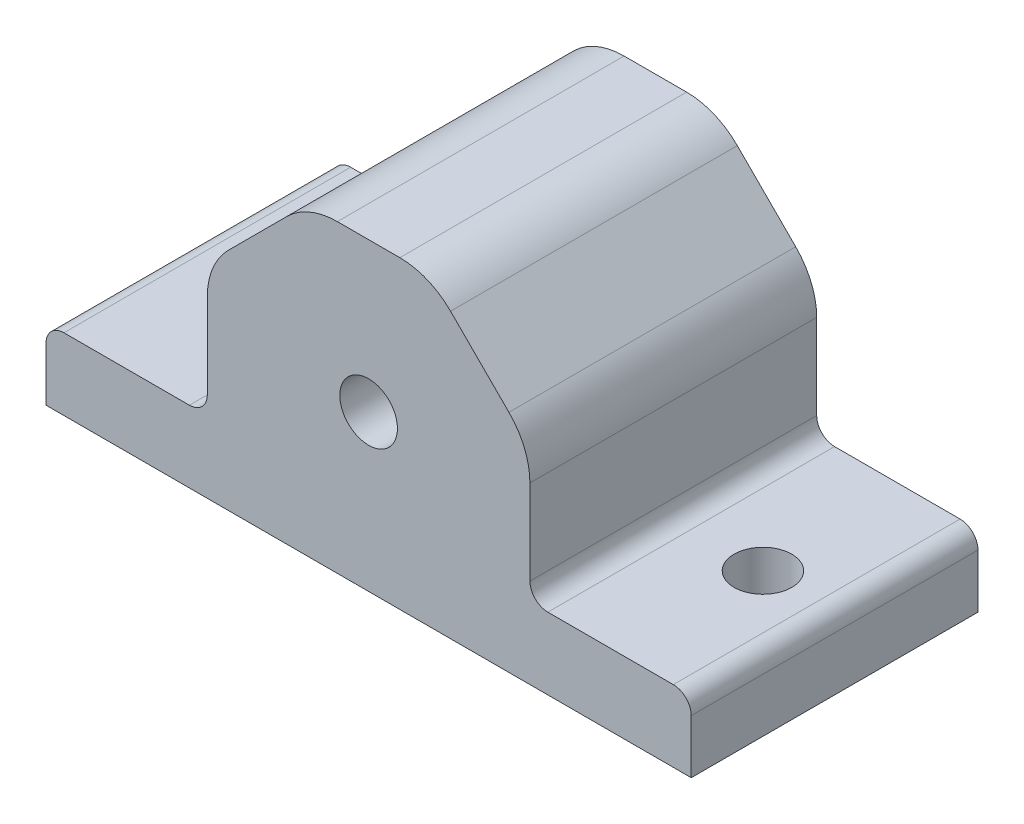
from build123d import *

# Parameters (mm, degrees)
BOSS_EXTRUDE1_DEPTH = 25.4
FILLET1_R           = 1.5875
FILLET3_R           = 6.35
SKETCH2_R           = 2.5527
CUT_EXTRUDE1_DEPTH  = 47.797604439
SKETCH4_R           = 2.5527
CUT_EXTRUDE2_DEPTH  = 47.797604439


with BuildPart() as part:
    # Sketch1 → Boss-Extrude1 (new body)
    with BuildSketch(Plane.XY):
        Polygon((-5.3975, 26.9875), (5.3975, 26.9875), (14.2875, 18.0975), (14.2875, 6.35), (28.575, 6.35), (28.575, 0), (-28.575, 0), (-28.575, 6.35), (-14.2875, 6.35), (-14.2875, 18.0975), align=None)
    extrude(amount=-BOSS_EXTRUDE1_DEPTH)

    # Fillet1
    fillet1_edges = [part.edges().sort_by_distance(p)[0] for p in [
        (14.2875, 6.35, -12.7),
        (28.575, 6.35, -12.7),
        (-28.575, 6.35, -12.7),
        (-14.2875, 6.35, -12.7),
    ]]
    fillet(fillet1_edges, radius=FILLET1_R)

    # Fillet3
    fillet3_edges = [part.edges().sort_by_distance(p)[0] for p in [
        (-5.3975, 26.9875, -12.7),
        (5.3975, 26.9875, -12.7),
        (14.2875, 18.0975, -12.7),
        (-14.2875, 18.0975, -12.7),
    ]]
    fillet(fillet3_edges, radius=FILLET3_R)

    # Sketch2 → Cut-Extrude1 (cut, through all)
    with BuildSketch(Plane.XZ):
        with Locations(Location((-22.225, -12.7, 0), (0, 0, 180))):
            Circle(SKETCH2_R)
    cut_extrude1 = extrude(amount=-CUT_EXTRUDE1_DEPTH, mode=Mode.SUBTRACT)

    # Mirror1: Cut-Extrude1 across plane
    add(cut_extrude1.mirror(Plane(origin=(0, 0, 0), x_dir=(0, 0, 1), z_dir=(1, 0, 0))), mode=Mode.SUBTRACT)

    # Sketch4 → Cut-Extrude2 (cut, through all)
    with BuildSketch(Plane(origin=(0, 0, -25.4), x_dir=(-1, 0, 0), z_dir=(0, 0, -1))):
        with Locations(Location((0, 13.7668, 0), (0, 0, 180))):
            Circle(SKETCH4_R)
    extrude(amount=-CUT_EXTRUDE2_DEPTH, mode=Mode.SUBTRACT)


solid = part.part
